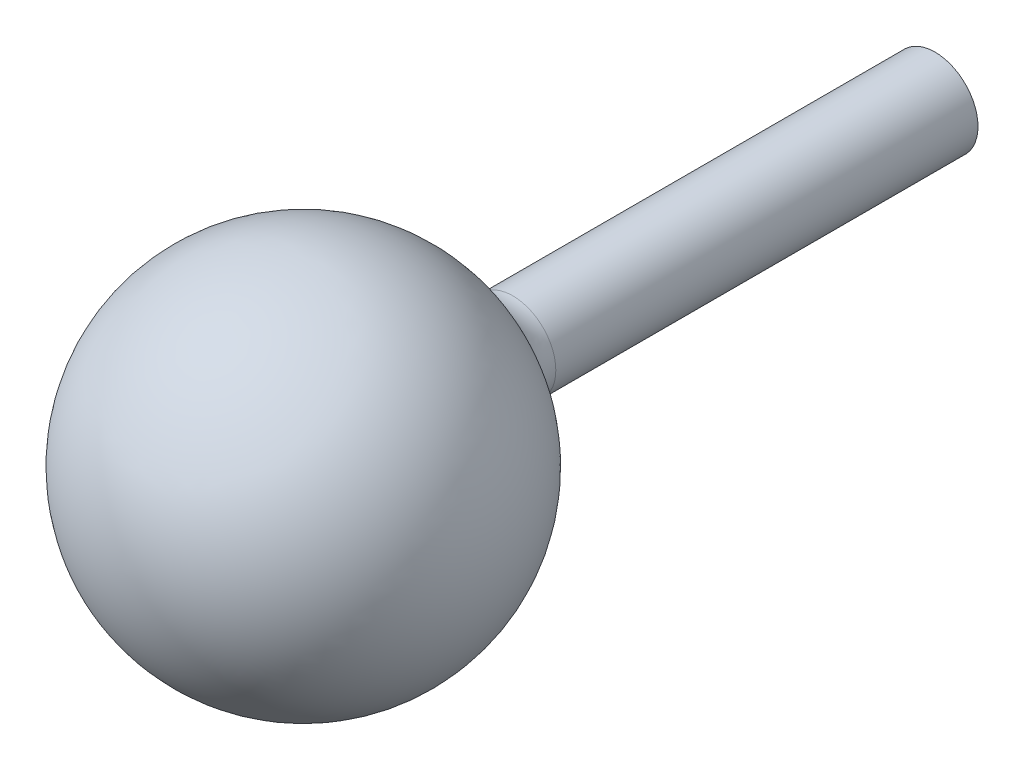
from build123d import *

# Parameters (mm, degrees)
SKETCH1_R           = 6
BOSS_EXTRUDE1_DEPTH = 63.5
SKETCH3_W           = 1.4
SKETCH3_H           = 2.2
CUT_EXTRUDE1_DEPTH  = 50.8
FILLET1_R           = 6.35


with BuildPart() as part:
    # Sketch1 → Boss-Extrude1 (new body)
    with BuildSketch(Plane.XY):
        Circle(SKETCH1_R)
    extrude(amount=BOSS_EXTRUDE1_DEPTH)

    # Sketch2 → Revolve1 (revolve)
    with BuildSketch(Plane(origin=(0, 0, 0), x_dir=(0, 0, -1), z_dir=(1, 0, 0))):
        with BuildLine():
            Line((-63.5, 0), (-113.581166909, 0))
            ThreePointArc((-113.581166909, 0), (-91.202620244, 25.21965146), (-63.5, 6))
            Line((-63.5, 6), (-63.5, 0))
        make_face()
    revolve(axis=Axis((0, 0, 63.5), (0, 0, 1)))

    # Sketch3 → Cut-Extrude1 (cut)
    with BuildSketch(Plane(origin=(0, 0, 0), x_dir=(-1, 0, 0), z_dir=(0, 0, -1))):
        Rectangle(SKETCH3_W, SKETCH3_H)
    extrude(amount=-CUT_EXTRUDE1_DEPTH, mode=Mode.SUBTRACT)

    # Fillet1
    fillet1_edges = [part.edges().sort_by_distance(p)[0] for p in [
        (-4.242640687, -4.242640687, 63.5),
    ]]
    fillet(fillet1_edges, radius=FILLET1_R)


solid = part.part
